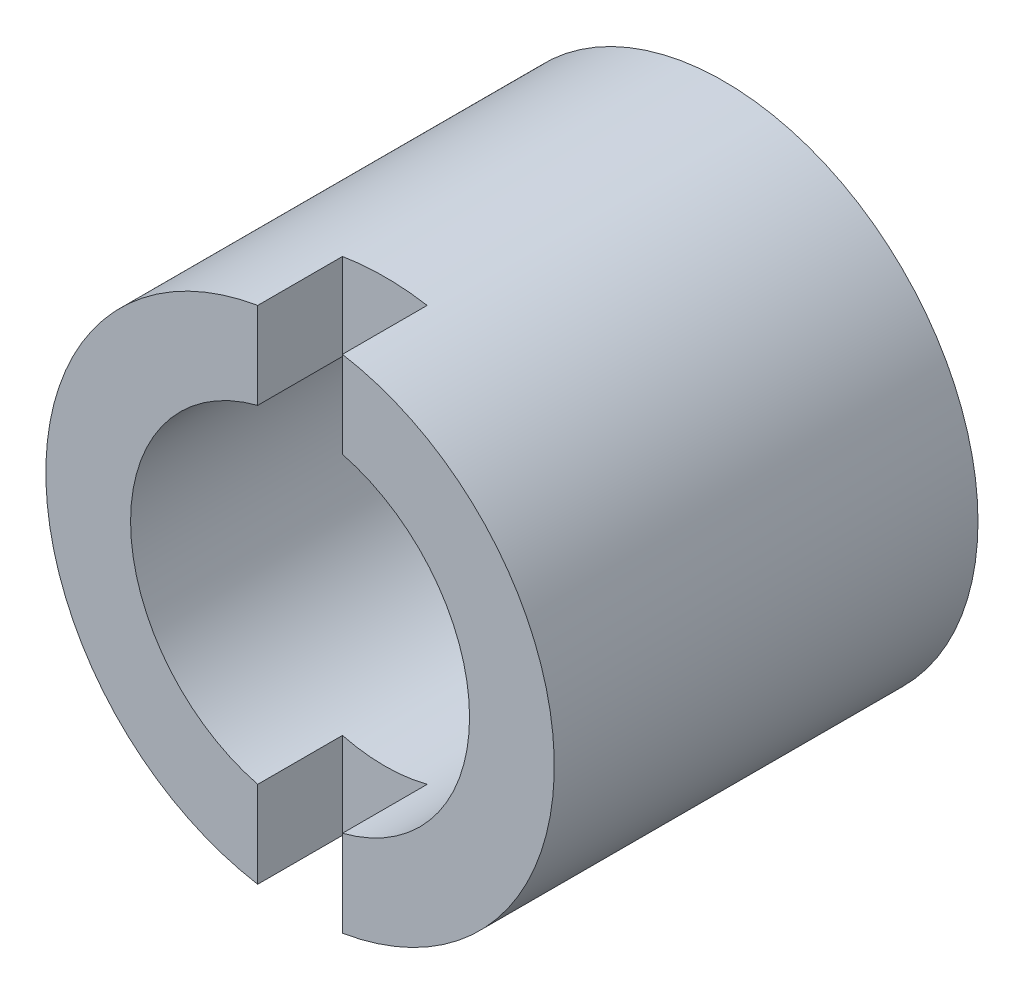
from build123d import *

# Parameters (mm, degrees)
SKETCH1_R               = 6
BOSS_EXTRUDE1_DEPTH     = 10
SKETCH2_R               = 4
CUT_EXTRUDE1_DEPTH      = 14.114877049
CUT_EXTRUDE4_DEPTH      = 14.114877049
CUT_EXTRUDE4_DEPTH_BACK = 14.114877049
SKETCH3_W               = 2
SKETCH3_H               = 2


with BuildPart() as part:
    # Sketch1 → Boss-Extrude1 (new body)
    with BuildSketch(Plane.XY):
        Circle(SKETCH1_R)
    extrude(amount=BOSS_EXTRUDE1_DEPTH)

    # Sketch2 → Cut-Extrude1 (cut, through all)
    with BuildSketch(Plane.XY.offset(10)):
        Circle(SKETCH2_R)
    extrude(amount=-CUT_EXTRUDE1_DEPTH, mode=Mode.SUBTRACT)

    # Sketch3 → Cut-Extrude4 (cut, two sides: drawn at the far end of the back side and taken through both)
    with BuildSketch(Plane(origin=(0, 0, 0), x_dir=(1, 0, 0), z_dir=(0, 1, 0)).offset(-CUT_EXTRUDE4_DEPTH_BACK)):
        with Locations((0, -9)):
            Rectangle(SKETCH3_W, SKETCH3_H)
    extrude(amount=CUT_EXTRUDE4_DEPTH + CUT_EXTRUDE4_DEPTH_BACK, mode=Mode.SUBTRACT)


solid = part.part
